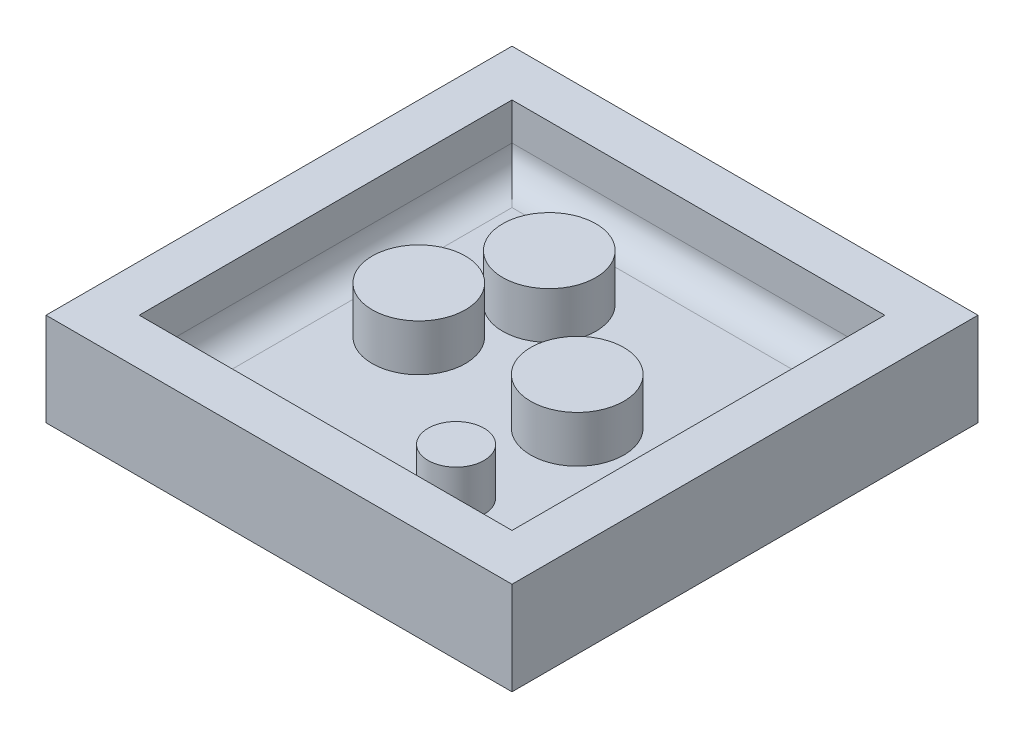
from build123d import *

# Parameters (mm, degrees)
SKETCH1_W           = 50
SKETCH1_H           = 50
BOSS_EXTRUDE1_DEPTH = 10
SKETCH2_W           = 40
SKETCH2_H           = 40
CUT_EXTRUDE1_DEPTH  = 7
FILLET1_R           = 3
SKETCH3_R           = 5
SKETCH3_R_2         = 3
BOSS_EXTRUDE2_DEPTH = 5


with BuildPart() as part:
    # Sketch1 → Boss-Extrude1 (new body)
    with BuildSketch(Plane(origin=(0, 0, 0), x_dir=(1, 0, 0), z_dir=(0, 1, 0))):
        with Locations((25, 25)):
            Rectangle(SKETCH1_W, SKETCH1_H)
    extrude(amount=BOSS_EXTRUDE1_DEPTH)

    # Sketch2 → Cut-Extrude1 (cut)
    with BuildSketch(Plane(origin=(0, 10, 0), x_dir=(1, 0, 0), z_dir=(0, 1, 0))):
        with Locations((25, 25)):
            Rectangle(SKETCH2_W, SKETCH2_H)
    extrude(amount=-CUT_EXTRUDE1_DEPTH, mode=Mode.SUBTRACT)

    # Fillet1
    fillet1_edges = [part.edges().sort_by_distance(p)[0] for p in [
        (5, 3, -25),
        (25, 3, -45),
        (45, 3, -25),
        (25, 3, -5),
    ]]
    fillet(fillet1_edges, radius=FILLET1_R)

    # Sketch3 → Boss-Extrude2 (add)
    with BuildSketch(Plane(origin=(0, 3, 0), x_dir=(1, 0, 0), z_dir=(0, 1, 0))):
        with Locations(Location((19, 35, 0), (0, 0, 270))):
            Circle(SKETCH3_R)
        with Locations(Location((32, 25, 0), (0, 0, 270))):
            Circle(SKETCH3_R)
        with Locations(Location((15, 25, 0), (0, 0, 270))):
            Circle(SKETCH3_R)
        with Locations(Location((32, 12, 0), (0, 0, 270))):
            Circle(SKETCH3_R_2)
    extrude(amount=BOSS_EXTRUDE2_DEPTH)


solid = part.part
